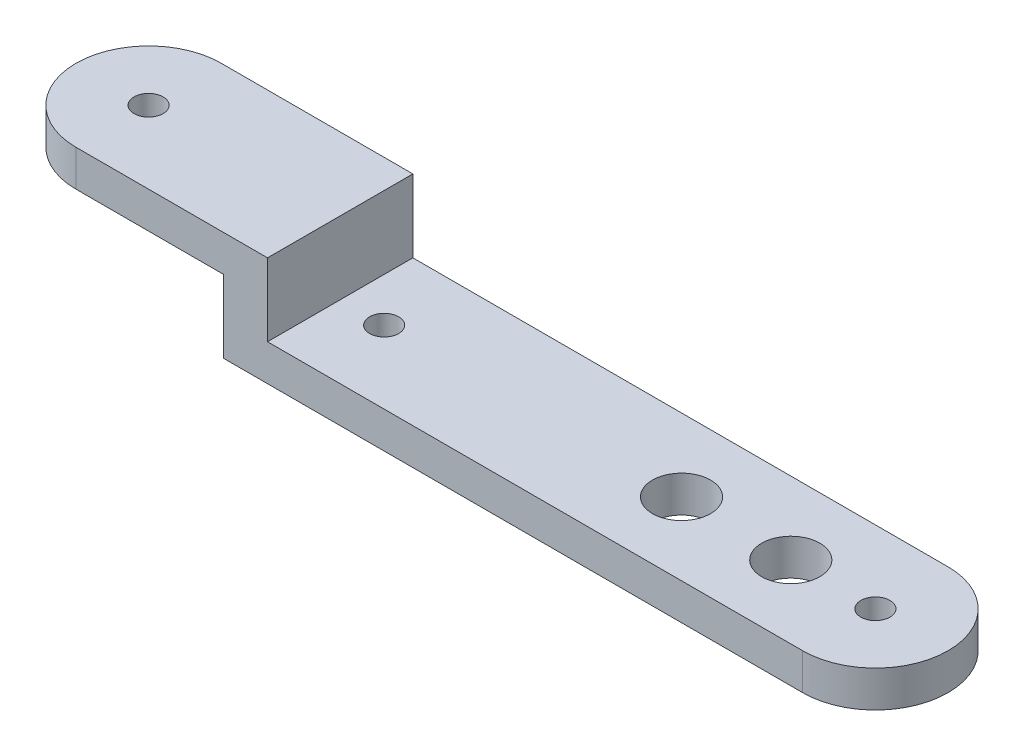
from build123d import *

# Parameters (mm, degrees)
SKETCH_2_R          = 2
SKETCH_2_R_2        = 4
EXTRUDE_1_DEPTH     = 15
SKETCH_3_W          = 98.28308004
SKETCH_3_H          = 42.939209726
CUT_EXTRUDE_1_DEPTH = 10
SKETCH_4_W          = 17.609413282
SKETCH_4_H          = 10.32275951
EXTRUDE_2_DEPTH     = 15
SKETCH_5_W          = 36.098979715
SKETCH_5_H          = 26.284001105
CUT_EXTRUDE_2_DEPTH = 10


with BuildPart() as part:
    # 草图2 → 凸台-拉伸1 (new body)
    with BuildSketch(Plane(origin=(0, 0, 0), x_dir=(1, 0, 0), z_dir=(0, 1, 0))):
        with BuildLine():
            Line((0, 10), (100, 10))
            ThreePointArc((100, 10), (110, 0), (100, -10))
            Line((100, -10), (0, -10))
            ThreePointArc((0, -10), (-10, 0), (0, 10))
        make_face()
        with Locations(Location((0, 0, 0), (0, 0, 270))):
            Circle(SKETCH_2_R, mode=Mode.SUBTRACT)
        with Locations(Location((10.16682634, 0, 0), (0, 0, 270))):
            Circle(SKETCH_2_R, mode=Mode.SUBTRACT)
        with Locations(Location((20.833686735, 0, 0), (0, 0, 270))):
            Circle(SKETCH_2_R, mode=Mode.SUBTRACT)
        with Locations(Location((32.412244599, 0, 0), (0, 0, 270))):
            Circle(SKETCH_2_R, mode=Mode.SUBTRACT)
        with Locations(Location((100, 0, 0), (0, 0, 270))):
            Circle(SKETCH_2_R, mode=Mode.SUBTRACT)
        with Locations(Location((88.357359208, 0, 0), (0, 0, 270))):
            Circle(SKETCH_2_R_2, mode=Mode.SUBTRACT)
        with Locations(Location((73.321402027, 0, 0), (0, 0, 270))):
            Circle(SKETCH_2_R_2, mode=Mode.SUBTRACT)
    extrude(amount=EXTRUDE_1_DEPTH)

    # 草图3 → 切除-拉伸1 (cut)
    with BuildSketch(Plane(origin=(0, 15, 0), x_dir=(1, 0, 0), z_dir=(0, 1, 0))):
        with Locations((75.503288201, -4.727650364)):
            Rectangle(SKETCH_3_W, SKETCH_3_H)
    extrude(amount=-CUT_EXTRUDE_1_DEPTH, mode=Mode.SUBTRACT)

    # 草图4 → 凸台-拉伸2 (add)
    with BuildSketch(Plane(origin=(0, 15, 0), x_dir=(1, 0, 0), z_dir=(0, 1, 0))):
        with Locations((15.041411071, 0.216864696)):
            Rectangle(SKETCH_4_W, SKETCH_4_H)
    extrude(amount=-EXTRUDE_2_DEPTH)

    # 草图5 → 切除-拉伸2 (cut)
    with BuildSketch(Plane.XZ):
        with Locations((2.252741217, 0.303610574)):
            Rectangle(SKETCH_5_W, SKETCH_5_H)
    extrude(amount=-CUT_EXTRUDE_2_DEPTH, mode=Mode.SUBTRACT)


solid = part.part
